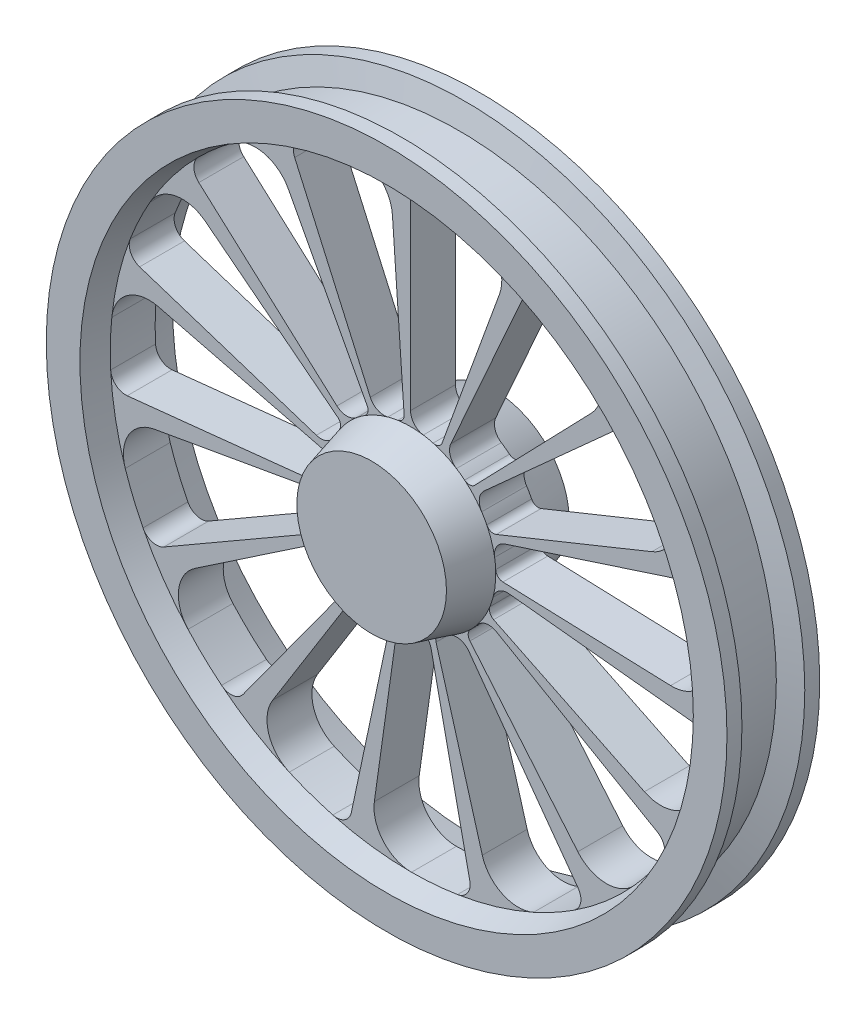
from build123d import *

# Parameters (mm, degrees)
CUT_EXTRUDE1_DEPTH = 654.141638544
CIRPATTERN1_COUNT  = 15


with BuildPart() as part:
    # Sketch1 → Revolve2 (revolve)
    with BuildSketch(Plane(origin=(0, 0, 0), x_dir=(0, 0, -1), z_dir=(1, 0, 0)), mode=Mode.PRIVATE) as revolve2_sk:
        Polygon((-82, 0), (82, 0), (82, 100), (30, 113.933358006), (30, 401.425625842), (62, 410), (62, 455), (42, 455), (33.961524227, 425), (-33.961524227, 425), (-42, 455), (-62, 455), (-62, 410), (-30, 401.425625842), (-30, 113.933358006), (-82, 100), align=None)
    revolve(revolve2_sk.sketch.rotate(Axis((0, 0, 82), (0, 0, -1)), 90), axis=Axis((0, 0, 82), (0, 0, -1)))

    # Sketch3 → Cut-Extrude1 (cut, symmetric)
    with BuildSketch(Plane.XY.offset(30)):
        with BuildLine():
            Line((0, 380.900916314), (0, 132.431659307))
            ThreePointArc((0, 132.431659307), (4.83868082, 119.388101483), (17.013440072, 112.655904965))
            ThreePointArc((17.013440072, 112.655904965), (23.649020488, 111.451935365), (30.201742548, 109.857475001))
            ThreePointArc((30.201742548, 109.857475001), (37.441245649, 110.614686646), (42.249494034, 116.079530842))
            Line((42.249494034, 116.079530842), (76.722383905, 210.793017345))
            Line((76.722383905, 210.793017345), (118.971877939, 326.872548187))
            ThreePointArc((118.971877939, 326.872548187), (115.680172839, 368.282570612), (82.22942072, 392.913292535))
            ThreePointArc((82.22942072, 392.913292535), (51.79221228, 398.070470934), (21.048697237, 400.873403243))
            ThreePointArc((21.048697237, 400.873403243), (6.233626925, 395.409085474), (0, 380.900916314))
        make_face()
    cut_extrude1 = extrude(amount=CUT_EXTRUDE1_DEPTH, both=True, mode=Mode.SUBTRACT)

    # CirPattern1: Cut-Extrude1 ×15 about axis
    cirpattern1_axis = Axis((0, 0, 0), (0, 0, 1))
    for i in range(1, CIRPATTERN1_COUNT):
        add(cut_extrude1.rotate(cirpattern1_axis, i * 360 / CIRPATTERN1_COUNT), mode=Mode.SUBTRACT)


solid = part.part
